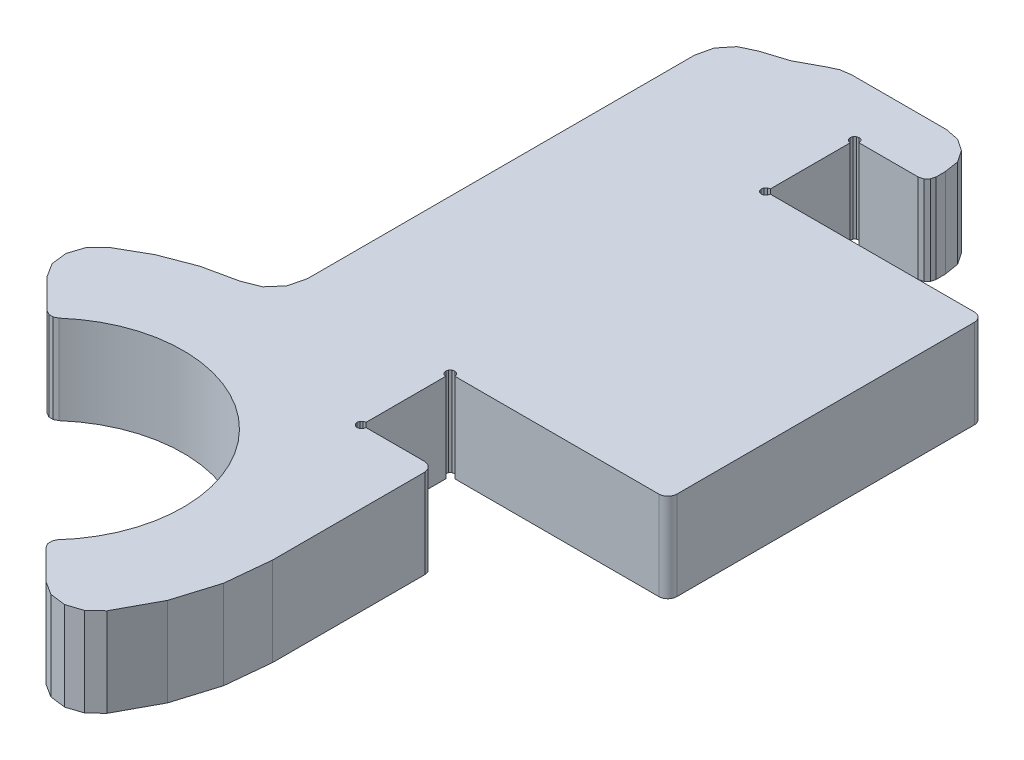
from build123d import *

# Parameters (mm, degrees)
BOSS_EXTRU_1_DEPTH = 4.900038


with BuildPart() as part:
    # Esquisse1 → Boss.-Extru.1 (new body)
    with BuildSketch(Plane(origin=(0, 4.900038, 0), x_dir=(1, 0, 0), z_dir=(0, 1, 0))):
        with BuildLine():
            Line((20.352144301, -2.543463741), (20.352144301, -2.043462703))
            Line((20.352144301, -2.043462703), (20.222233634, -1.234634479))
            Line((20.222233634, -1.234634479), (19.788693601, -0.58578943))
            Line((19.788693601, -0.58578943), (19.139843552, -0.152243798))
            Line((19.139843552, -0.152243798), (18.374483494, -2.386e-06))
            Line((18.374483494, -2.386e-06), (13.150843099, -2.386e-06))
            Line((13.150843099, -2.386e-06), (12.570463055, -0.086064053))
            Line((12.570463055, -0.086064053), (12.040033015, -0.336843111))
            Line((12.040033015, -0.336843111), (10.798452921, -1.006549462))
            Line((10.798452921, -1.006549462), (9.453426819, -1.431914494))
            Line((9.453426819, -1.431914494), (8.640349758, -1.813265523))
            Line((8.640349758, -1.813265523), (8.076110715, -2.511950576))
            Line((8.076110715, -2.511950576), (7.8744797, -3.387092642))
            Line((7.8744797, -3.387092642), (7.8744797, -24.738594256))
            Line((7.8744797, -24.738594256), (7.650796683, -25.657674326))
            Line((7.650796683, -25.657674326), (7.029780636, -26.37116438))
            Line((7.029780636, -26.37116438), (6.15034157, -26.719484406))
            Line((6.15034157, -26.719484406), (4.29809943, -27.122544437))
            Line((4.29809943, -27.122544437), (2.528101296, -27.801054488))
            Line((2.528101296, -27.801054488), (0.881055671, -28.739404559))
            Line((0.881055671, -28.739404559), (0.280930026, -29.374954607))
            Line((0.280930026, -29.374954607), (0.009177495, -30.20574467))
            Line((0.009177495, -30.20574467), (0.117708214, -31.073094735))
            Line((0.117708214, -31.073094735), (0.585789149, -31.811314791))
            Line((0.585789149, -31.811314791), (2.228685273, -33.454204915))
            Line((2.228685273, -33.454204915), (2.442788289, -33.580814925))
            Line((2.442788289, -33.580814925), (2.691403308, -33.588594925))
            Line((2.691403308, -33.588594925), (2.913002325, -33.475614917))
            ThreePointArc((2.913002325, -33.475614917), (13.213872644, -33.833045583), (13.430577738, -44.137836939))
            Line((13.430577738, -44.137836939), (13.363553773, -44.3265459))
            Line((13.363553773, -44.3265459), (13.371323773, -44.575155919))
            Line((13.371323773, -44.575155919), (13.497933783, -44.789265935))
            Line((13.497933783, -44.789265935), (15.140833907, -46.432156059))
            Line((15.140833907, -46.432156059), (15.879053963, -46.900236095))
            Line((15.879053963, -46.900236095), (16.746394029, -47.008766103))
            Line((16.746394029, -47.008766103), (17.577194091, -46.737016082))
            Line((17.577194091, -46.737016082), (18.212744139, -46.136886037))
            Line((18.212744139, -46.136886037), (19.385584228, -43.963185873))
            Line((19.385584228, -43.963185873), (20.108124283, -41.601305694))
            Line((20.108124283, -41.601305694), (20.352144301, -39.143465508))
            Line((20.352144301, -39.143465508), (20.352144301, -30.743464873))
            Line((20.352144301, -30.743464873), (20.285154296, -30.493464854))
            Line((20.285154296, -30.493464854), (20.102144282, -30.31045484))
            Line((20.102144282, -30.31045484), (19.852144263, -30.243464835))
            Line((19.852144263, -30.243464835), (16.602144018, -30.243464835))
            Line((16.602144018, -30.243464835), (16.568644015, -30.368465215))
            Line((16.568644015, -30.368465215), (16.477144008, -30.459975222))
            Line((16.477144008, -30.459975222), (16.352143999, -30.493465225))
            Line((16.352143999, -30.493465225), (16.227143989, -30.459975222))
            Line((16.227143989, -30.459975222), (16.135633982, -30.368465215))
            Line((16.135633982, -30.368465215), (16.10214398, -30.243465206))
            Line((16.10214398, -30.243465206), (16.135633982, -30.118465196))
            Line((16.135633982, -30.118465196), (16.227143989, -30.026955189))
            Line((16.227143989, -30.026955189), (16.352143999, -29.993465187))
            Line((16.352143999, -29.993465187), (16.352143999, -25.593464854))
            Line((16.352143999, -25.593464854), (16.227143989, -25.559974852))
            Line((16.227143989, -25.559974852), (16.135633982, -25.468464845))
            Line((16.135633982, -25.468464845), (16.10214398, -25.343464835))
            Line((16.10214398, -25.343464835), (16.135633982, -25.218464826))
            Line((16.135633982, -25.218464826), (16.227143989, -25.126954819))
            Line((16.227143989, -25.126954819), (16.352143999, -25.093464816))
            Line((16.352143999, -25.093464816), (16.477144008, -25.126954819))
            Line((16.477144008, -25.126954819), (16.568644015, -25.218464826))
            Line((16.568644015, -25.218464826), (16.602144018, -25.343464835))
            Line((16.602144018, -25.343464835), (27.852144868, -25.343464835))
            ThreePointArc((27.852144868, -25.343464835), (28.205698285, -25.197018215), (28.352144906, -24.843464798))
            Line((28.352144906, -24.843464798), (28.352144906, -8.443464873))
            ThreePointArc((28.352144906, -8.443464873), (28.205698285, -8.089911456), (27.852144868, -7.943464835))
            Line((27.852144868, -7.943464835), (16.602144018, -7.943464835))
            Line((16.602144018, -7.943464835), (16.568644015, -8.068465529))
            Line((16.568644015, -8.068465529), (16.477144008, -8.159969536))
            Line((16.477144008, -8.159969536), (16.352143999, -8.193464539))
            Line((16.352143999, -8.193464539), (16.227143989, -8.159969536))
            Line((16.227143989, -8.159969536), (16.135633982, -8.068465529))
            Line((16.135633982, -8.068465529), (16.10214398, -7.94346352))
            Line((16.10214398, -7.94346352), (16.135633982, -7.81846451))
            Line((16.135633982, -7.81846451), (16.227143989, -7.726956504))
            Line((16.227143989, -7.726956504), (16.352143999, -7.693462501))
            Line((16.352143999, -7.693462501), (16.352143999, -3.293462168))
            Line((16.352143999, -3.293462168), (16.227143989, -3.259968166))
            Line((16.227143989, -3.259968166), (16.135633982, -3.168464159))
            Line((16.135633982, -3.168464159), (16.10214398, -3.043462149))
            Line((16.10214398, -3.043462149), (16.135633982, -2.91846314))
            Line((16.135633982, -2.91846314), (16.227143989, -2.826955133))
            Line((16.227143989, -2.826955133), (16.352143999, -2.793465131))
            Line((16.352143999, -2.793465131), (16.477144008, -2.826955133))
            Line((16.477144008, -2.826955133), (16.568644015, -2.91846314))
            Line((16.568644015, -2.91846314), (16.602144018, -3.043464835))
            Line((16.602144018, -3.043464835), (19.852144263, -3.043464835))
            Line((19.852144263, -3.043464835), (20.102144282, -2.97647983))
            Line((20.102144282, -2.97647983), (20.285154296, -2.793467816))
            Line((20.285154296, -2.793467816), (20.352144301, -2.543463741))
        make_face()
    extrude(amount=-BOSS_EXTRU_1_DEPTH)


solid = part.part
